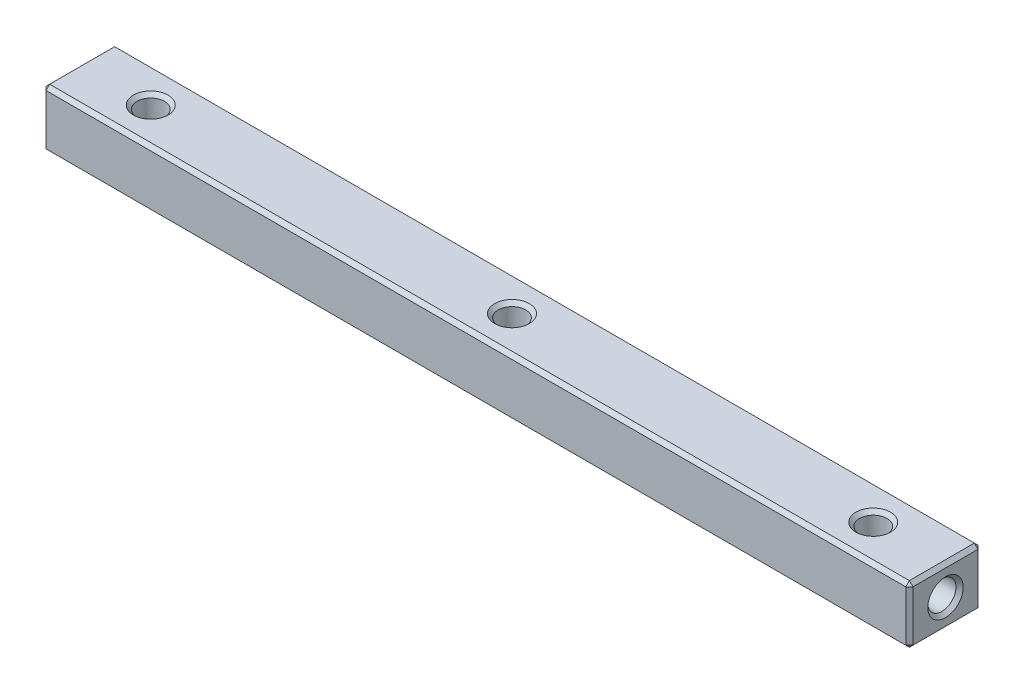
from build123d import *

# Parameters (mm, degrees)
SKETCH1_W           = 120
SKETCH1_H           = 10
SKETCH1_R           = 1.9
BOSS_EXTRUDE1_DEPTH = 4
SKETCH2_R           = 1.95
CUT_EXTRUDE1_DEPTH  = 8
CHAMFER1_SIZE       = 0.5


with BuildPart() as part:
    # Sketch1 → Boss-Extrude1 (new, symmetric)
    with BuildSketch(Plane(origin=(0, 0, 0), x_dir=(1, 0, 0), z_dir=(0, 1, 0))):
        Rectangle(SKETCH1_W, SKETCH1_H)
        with Locations(Location((-50, 0, 0), (0, 0, 270))):
            Circle(SKETCH1_R, mode=Mode.SUBTRACT)
        with Locations(Location((50, 0, 0), (0, 0, 90))):
            Circle(SKETCH1_R, mode=Mode.SUBTRACT)
        with Locations(Location((0, 0, 0), (0, 0, 270))):
            Circle(SKETCH1_R, mode=Mode.SUBTRACT)
    extrude(amount=BOSS_EXTRUDE1_DEPTH, both=True)

    # Sketch2 → Cut-Extrude1 (cut)
    with BuildSketch(Plane.ZY.offset(60)):
        Circle(SKETCH2_R)
    cut_extrude1 = extrude(amount=-CUT_EXTRUDE1_DEPTH, mode=Mode.SUBTRACT)

    # Mirror1: Cut-Extrude1 across plane
    add(cut_extrude1.mirror(Plane(origin=(0, 0, 0), x_dir=(0, 0, 1), z_dir=(1, 0, 0))), mode=Mode.SUBTRACT)

    # Chamfer1
    chamfer1_edges = [part.edges().sort_by_distance(p)[0] for p in [
        (-50, -4, -1.9),
        (-50, 4, -1.9),
        (-60, 4, 0),
        (50, -4, 1.9),
        (50, 4, 1.9),
        (0, 4, 5),
        (0, -4, -1.9),
        (0, 4, -1.9),
        (-60, 0, -1.95),
        (60, 0, -1.95),
        (60, 4, 0),
        (0, -4, 5),
        (-60, -4, 0),
        (0, -4, -5),
        (60, -4, 0),
        (60, 0, 5),
        (-60, 0, 5),
        (-60, 0, -5),
        (60, 0, -5),
        (0, 4, -5),
    ]]
    chamfer(chamfer1_edges, length=CHAMFER1_SIZE)


solid = part.part
